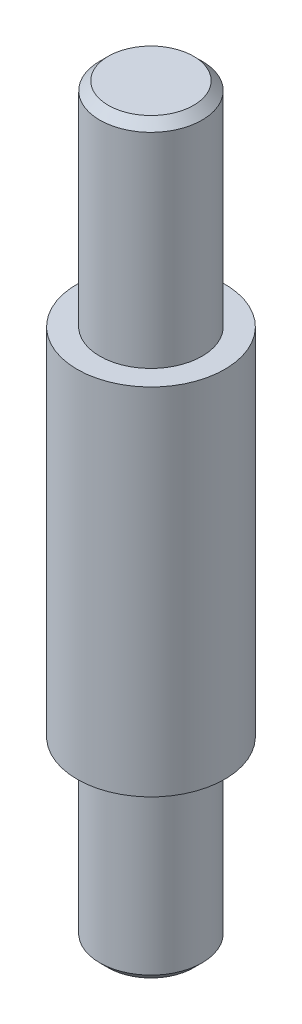
from build123d import *


with BuildPart() as part:
    # Sketch1 → Revolve1 (revolve)
    with BuildSketch(Plane(origin=(0, 0, 0), x_dir=(0, 0, -1), z_dir=(1, 0, 0))):
        Polygon((0, 33.401), (-3.81, 33.401), (-4.572, 32.639), (-4.572, 14.351), (-6.604, 14.351), (-6.604, -17.399), (-4.572, -17.399), (-4.572, -32.639), (-3.81, -33.401), (0, -33.401), align=None)
    revolve(axis=Axis((0, 33.401, 0), (0, -1, 0)))


solid = part.part
